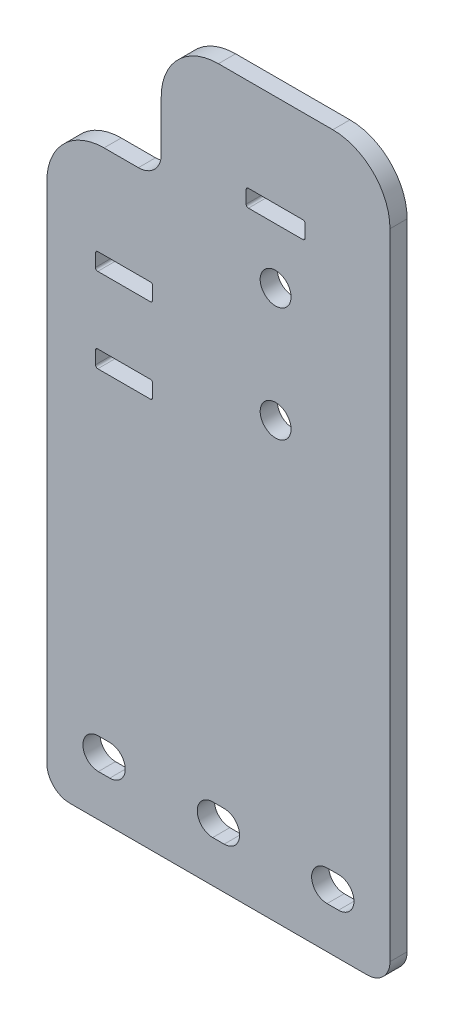
from build123d import *

# Parameters (mm, degrees)
MODEL_R                         = 2.7
AUFSATZ_LINEAR_AUSTRAGEN1_DEPTH = 3


with BuildPart() as part:
    # Model → Aufsatz-Linear austragen1 (new body)
    with BuildSketch(Plane.XY):
        with BuildLine():
            Line((16, 102.25), (10, 102.25))
            ThreePointArc((10, 102.25), (2.928932188, 99.321067812), (0, 92.25))
            Line((0, 92.25), (0, 4))
            ThreePointArc((0, 4), (1.171572875, 1.171572875), (4, 0))
            Line((4, 0), (56, 0))
            ThreePointArc((56, 0), (58.828427125, 1.171572875), (60, 4))
            Line((60, 4), (60, 115))
            ThreePointArc((60, 115), (57.071067812, 122.071067812), (50, 125))
            Line((50, 125), (30, 125))
            ThreePointArc((30, 125), (22.928932188, 122.071067812), (20, 115))
            Line((20, 115), (20, 106.25))
            ThreePointArc((20, 106.25), (18.828427125, 103.421572875), (16, 102.25))
        make_face()
        with Locations((40, 76)):
            Circle(MODEL_R, mode=Mode.SUBTRACT)
        with Locations((40, 96)):
            Circle(MODEL_R, mode=Mode.SUBTRACT)
        with BuildLine():
            Line((11, 7.3), (9, 7.3))
            ThreePointArc((9, 7.3), (6.3, 10), (9, 12.7))
            Line((9, 12.7), (11, 12.7))
            ThreePointArc((11, 12.7), (13.7, 10), (11, 7.3))
        make_face(mode=Mode.SUBTRACT)
        with BuildLine():
            Line((31, 7.3), (29, 7.3))
            ThreePointArc((29, 7.3), (26.3, 10), (29, 12.7))
            Line((29, 12.7), (31, 12.7))
            ThreePointArc((31, 12.7), (33.7, 10), (31, 7.3))
        make_face(mode=Mode.SUBTRACT)
        with BuildLine():
            Line((51, 7.3), (49, 7.3))
            ThreePointArc((49, 7.3), (46.3, 10), (49, 12.7))
            Line((49, 12.7), (51, 12.7))
            ThreePointArc((51, 12.7), (53.7, 10), (51, 7.3))
        make_face(mode=Mode.SUBTRACT)
        with BuildLine():
            Line((18.1, 83), (8.9, 83))
            ThreePointArc((8.9, 83), (8.617157288, 83.117157288), (8.5, 83.4))
            Line((8.5, 83.4), (8.5, 85.6))
            ThreePointArc((8.5, 85.6), (8.617157288, 85.882842712), (8.9, 86))
            Line((8.9, 86), (18.1, 86))
            ThreePointArc((18.1, 86), (18.382842712, 85.882842712), (18.5, 85.6))
            Line((18.5, 85.6), (18.5, 83.4))
            ThreePointArc((18.5, 83.4), (18.382842712, 83.117157288), (18.1, 83))
        make_face(mode=Mode.SUBTRACT)
        with BuildLine():
            Line((18.1, 68.25), (8.9, 68.25))
            ThreePointArc((8.9, 68.25), (8.617157288, 68.367157288), (8.5, 68.65))
            Line((8.5, 68.65), (8.5, 70.85))
            ThreePointArc((8.5, 70.85), (8.617157288, 71.132842712), (8.9, 71.25))
            Line((8.9, 71.25), (18.1, 71.25))
            ThreePointArc((18.1, 71.25), (18.382842712, 71.132842712), (18.5, 70.85))
            Line((18.5, 70.85), (18.5, 68.65))
            ThreePointArc((18.5, 68.65), (18.382842712, 68.367157288), (18.1, 68.25))
        make_face(mode=Mode.SUBTRACT)
        with BuildLine():
            Line((44.75, 105.75), (35.25, 105.75))
            ThreePointArc((35.25, 105.75), (34.967157288, 105.867157288), (34.85, 106.15))
            Line((34.85, 106.15), (34.85, 108.35))
            ThreePointArc((34.85, 108.35), (34.967157288, 108.632842712), (35.25, 108.75))
            Line((35.25, 108.75), (44.75, 108.75))
            ThreePointArc((44.75, 108.75), (45.032842712, 108.632842712), (45.15, 108.35))
            Line((45.15, 108.35), (45.15, 106.15))
            ThreePointArc((45.15, 106.15), (45.032842712, 105.867157288), (44.75, 105.75))
        make_face(mode=Mode.SUBTRACT)
    extrude(amount=AUFSATZ_LINEAR_AUSTRAGEN1_DEPTH)


solid = part.part
